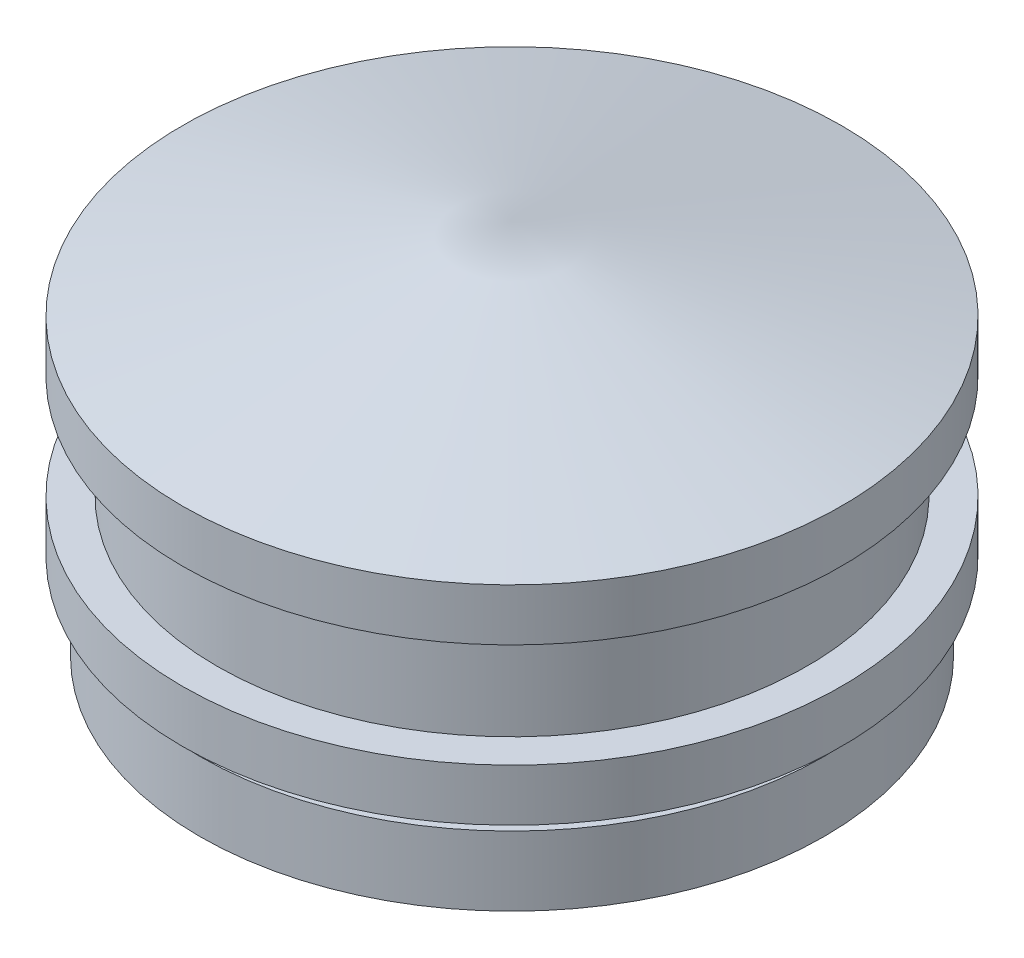
from build123d import *


with BuildPart() as part:
    # Эскиз1 → Повернуть1 (revolve)
    with BuildSketch(Plane.XY, mode=Mode.PRIVATE) as revolve_1_sk:
        Polygon((0, 0), (9.5, -2.368616027), (9.5, -3.868616027), (8.5, -3.868616027), (8.5, -6.868616027), (9.5, -6.868616027), (9.5, -8.368616027), (8.5, -8.368616027), (8.5, -8.868616027), (9, -8.868616027), (9, -10.868616027), (0, -10.868616027), align=None)
    revolve(revolve_1_sk.sketch.rotate(Axis((0, 0, 0), (0, -1, 0)), 90), axis=Axis((0, 0, 0), (0, -1, 0)))


solid = part.part
